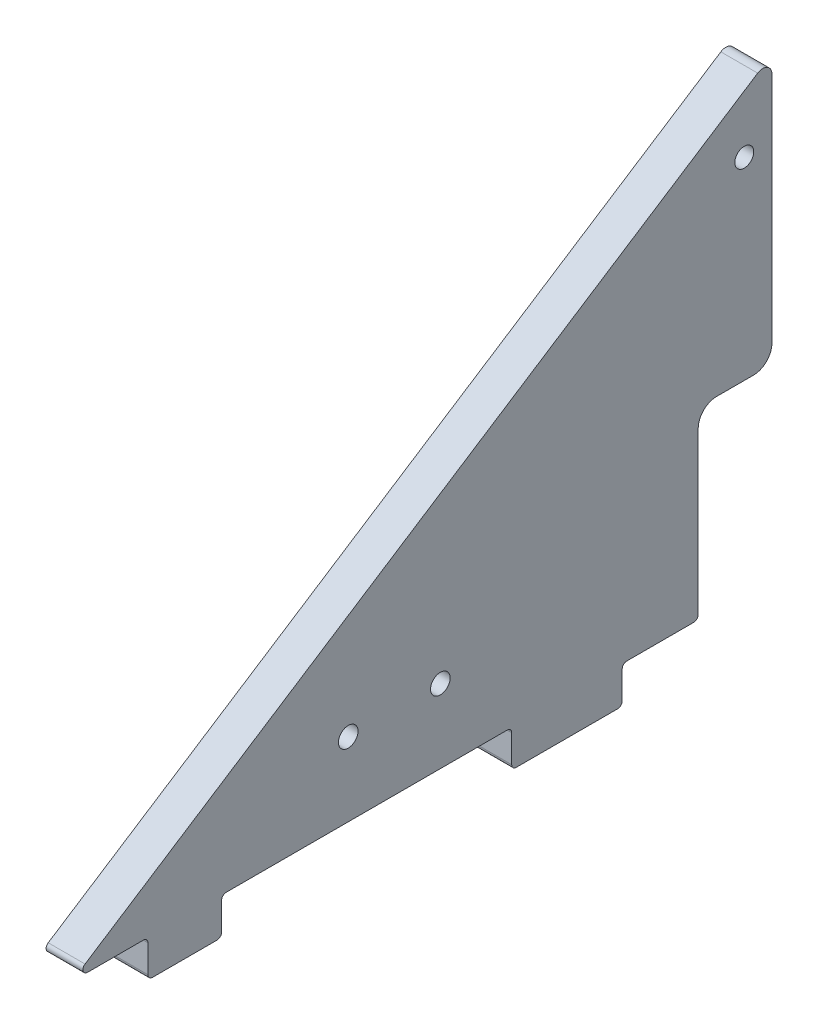
from build123d import *

# Parameters (mm, degrees)
SKETCH1_W               = 38.1
SKETCH1_H               = 12.7
SKETCH1_W_2             = 25.4
BOSS_EXTRUDE1_DEPTH     = 6.35
F_1_4_CLEARANCE_HOLE1_D = 6.7564
BOSS_EXTRUDE2_DEPTH     = 12.7
TOP_FILLET_R            = 3.175
BOTTOM_FILLETS_R        = 1.5875
F_1_4_CLEARANCE_HOLE2_D = 6.5278
FILLET1_R               = 6.35


with BuildPart() as part:
    # Sketch1 → Boss-Extrude1 (new, symmetric)
    with BuildSketch(Plane(origin=(0, 0, 0), x_dir=(0, 0, -1), z_dir=(1, 0, 0))):
        Polygon((0, 139.7), (0, 0), (-215.9, 0), align=None)
        with Locations((-45.24375, -6.35)):
            Rectangle(SKETCH1_W, SKETCH1_H)
        with Locations((-177.00625, -6.35)):
            Rectangle(SKETCH1_W_2, SKETCH1_H)
    extrude(amount=BOSS_EXTRUDE1_DEPTH, both=True)

    # 1/4 Clearance Hole1 (through all)
    with Locations(Plane(origin=(6.35, 0, 0), x_dir=(0, 0, -1), z_dir=(1, 0, 0))):
        with Locations((-88.9, 25.4), (-120.65, 25.4)):
            Hole(F_1_4_CLEARANCE_HOLE1_D / 2)

    # Sketch13 → Boss-Extrude2 (add, through all)
    with BuildSketch(Plane.ZY.offset(6.35)):
        Polygon((-25.4, 156.135294118), (0, 139.7), (0, 63.5), (-25.4, 63.5), align=None)
    extrude(amount=-BOSS_EXTRUDE2_DEPTH)

    # top fillet
    top_fillet_edges = [part.edges().sort_by_distance(p)[0] for p in [
        (0, 156.135294118, -25.4),
    ]]
    fillet(top_fillet_edges, radius=TOP_FILLET_R)

    # bottom fillets
    bottom_fillets_edges = [part.edges().sort_by_distance(p)[0] for p in [
        (0, 0, 0),
        (0, 0, 26.19375),
        (0, -12.7, 26.19375),
        (0, -12.7, 64.29375),
        (0, 0, 64.29375),
        (0, 0, 164.30625),
        (0, -12.7, 164.30625),
        (0, -12.7, 189.70625),
        (0, 0, 189.70625),
        (0, 0, 215.9),
    ]]
    fillet(bottom_fillets_edges, radius=BOTTOM_FILLETS_R)

    # 1/4 Clearance Hole2 (through all)
    with Locations(Plane(origin=(6.35, 0, 0), x_dir=(0, 0, -1), z_dir=(1, 0, 0))):
        with Locations((15.875, 130.175)):
            Hole(F_1_4_CLEARANCE_HOLE2_D / 2)

    # Fillet1
    fillet1_edges = [part.edges().sort_by_distance(p)[0] for p in [
        (0, 63.5, -25.4),
        (0, 63.5, 0),
    ]]
    fillet(fillet1_edges, radius=FILLET1_R)


solid = part.part
